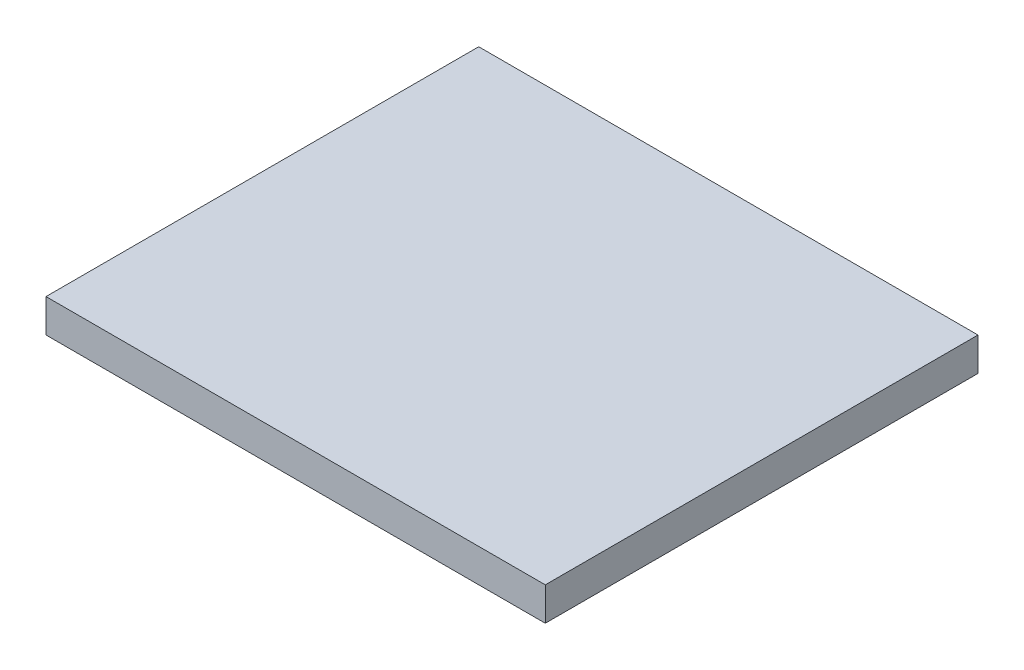
from build123d import *

# Parameters (mm, degrees)
SKETCH1_W           = 15000
SKETCH1_H           = 13000
BOSS_EXTRUDE1_DEPTH = 1000


with BuildPart() as part:
    # Sketch1 → Boss-Extrude1 (new body)
    with BuildSketch(Plane(origin=(0, 0, 0), x_dir=(1, 0, 0), z_dir=(0, 1, 0))):
        with Locations((7500, 6500)):
            Rectangle(SKETCH1_W, SKETCH1_H)
    extrude(amount=BOSS_EXTRUDE1_DEPTH)


solid = part.part
